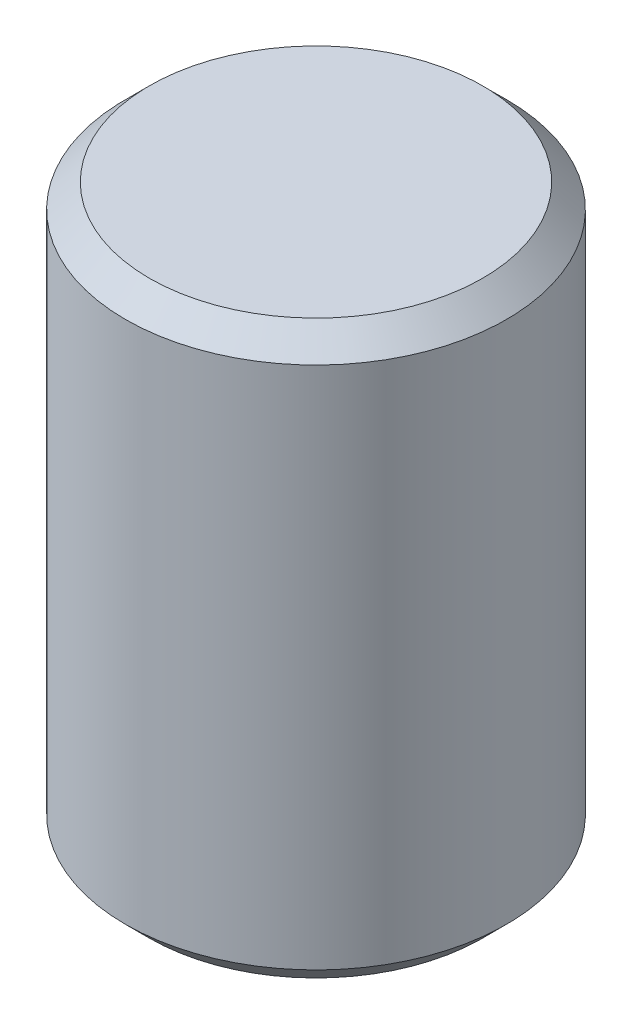
from build123d import *

# Parameters (mm, degrees)
SKETCH_1_R      = 4
EXTRUDE_1_DEPTH = 12
CHAMFER_1_SIZE  = 0.5


with BuildPart() as part:
    # 草图1 → 凸台-拉伸1 (new body)
    with BuildSketch(Plane(origin=(0, 0, 0), x_dir=(1, 0, 0), z_dir=(0, 1, 0))):
        with Locations(Location((0, 0, 0), (0, 0, 270))):
            Circle(SKETCH_1_R)
    extrude(amount=EXTRUDE_1_DEPTH)

    # 倒角1
    chamfer_1_edges = [part.edges().sort_by_distance(p)[0] for p in [
        (0, 0, -4),
        (0, 12, -4),
    ]]
    chamfer(chamfer_1_edges, length=CHAMFER_1_SIZE)


solid = part.part
